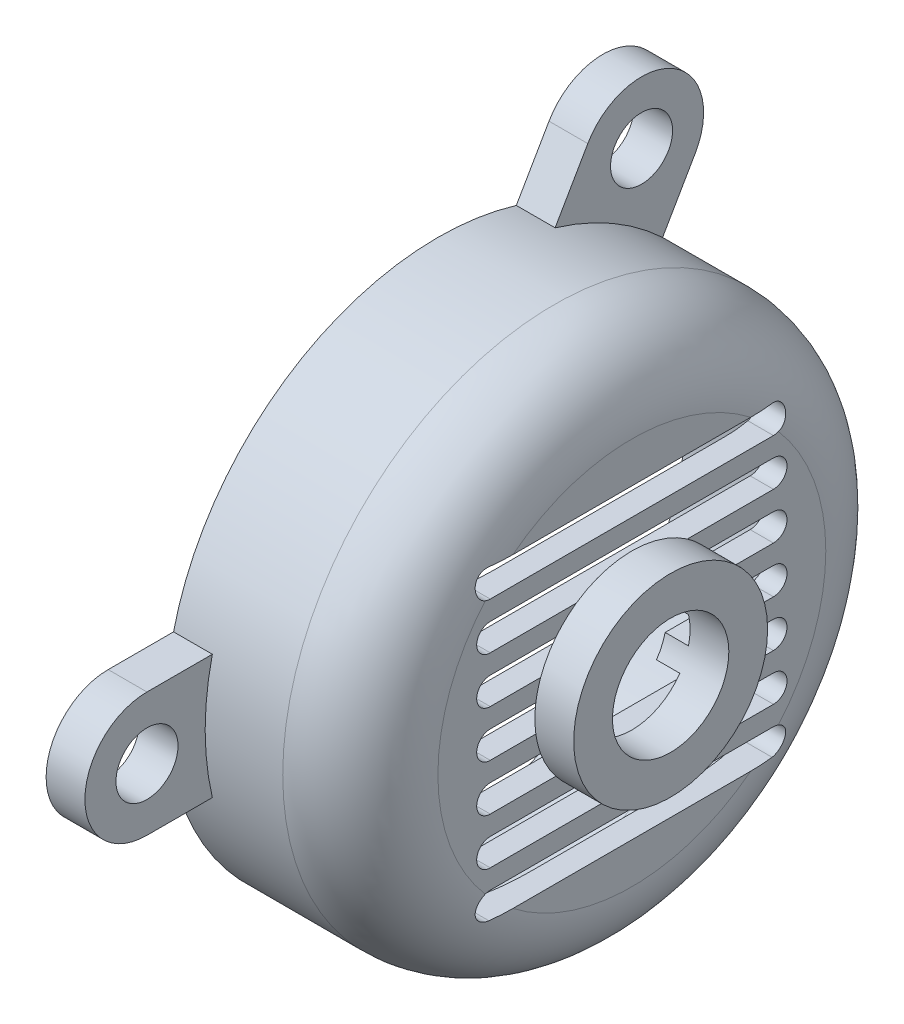
from build123d import *

# Parameters (mm, degrees)
BOSS_EXTRUDE1_START = 5
SKETCH3_R           = 4
BOSS_EXTRUDE1_DEPTH = 5
CIRPATTERN1_COUNT   = 3
CUT_EXTRUDE1_DEPTH  = 5


with BuildPart() as part:
    # Sketch2 → Revolve1 (revolve)
    with BuildSketch(Plane(origin=(0, 0, 0), x_dir=(-1, 0, 0), z_dir=(0, 1, 0)), mode=Mode.PRIVATE) as revolve1_sk:
        with BuildLine():
            Line((-12, 32), (0, 32))
            Line((0, 32), (0, 35))
            Line((0, 35), (-15, 35))
            ThreePointArc((-15, 35), (-22.071067812, 32.071067812), (-25, 25))
            Line((-25, 25), (-25, 12.5))
            Line((-25, 12.5), (-22, 12.5))
            Line((-22, 12.5), (-22, 22))
            ThreePointArc((-22, 22), (-19.071067812, 29.071067812), (-12, 32))
        make_face()
        Polygon((-22, 7.5), (-22, 12.5), (-25, 12.5), (-30, 12.5), (-30, 7.5), align=None)
    revolve(revolve1_sk.sketch.rotate(Axis((0, 0, 0), (-1, 0, 0)), 180), axis=Axis((0, 0, 0), (-1, 0, 0)))

    # Sketch3 → Boss-Extrude1 (add)
    with BuildSketch(Plane.YZ.offset(BOSS_EXTRUDE1_START)):
        with BuildLine():
            Line((8, 34.073450075), (8, 42.5))
            ThreePointArc((8, 42.5), (0, 50.5), (-8, 42.5))
            Line((-8, 42.5), (-8, 34.073450075))
            ThreePointArc((-8, 34.073450075), (0, 35), (8, 34.073450075))
        make_face()
        with Locations(Location((0, 42.5, 0), (0, 0, 270))):
            Circle(SKETCH3_R, mode=Mode.SUBTRACT)
    boss_extrude1 = extrude(amount=-BOSS_EXTRUDE1_DEPTH)

    # CirPattern1: Boss-Extrude1 ×3 about axis
    cirpattern1_axis = Axis((0, 0, 0), (1, 0, 0))
    for i in range(1, CIRPATTERN1_COUNT):
        add(boss_extrude1.rotate(cirpattern1_axis, i * 360 / CIRPATTERN1_COUNT))

    # Sketch4 → Cut-Extrude1 (cut)
    with BuildSketch(Plane.YZ.offset(25)):
        with BuildLine():
            Line((1.75, 18.25), (1.75, -18.25))
            ThreePointArc((1.75, -18.25), (0, -20), (-1.75, -18.25))
            Line((-1.75, -18.25), (-1.75, 18.25))
            ThreePointArc((-1.75, 18.25), (0, 20), (1.75, 18.25))
        make_face()
        with BuildLine():
            Line((7.75, 18.25), (7.75, -18.25))
            ThreePointArc((7.75, -18.25), (6, -20), (4.25, -18.25))
            Line((4.25, -18.25), (4.25, 18.25))
            ThreePointArc((4.25, 18.25), (6, 20), (7.75, 18.25))
        make_face()
        with BuildLine():
            Line((13.75, 18.25), (13.75, -18.25))
            ThreePointArc((13.75, -18.25), (12, -20), (10.25, -18.25))
            Line((10.25, -18.25), (10.25, 18.25))
            ThreePointArc((10.25, 18.25), (12, 20), (13.75, 18.25))
        make_face()
        with BuildLine():
            Line((19.75, 18.25), (19.75, -18.25))
            ThreePointArc((19.75, -18.25), (18, -20), (16.25, -18.25))
            Line((16.25, -18.25), (16.25, 18.25))
            ThreePointArc((16.25, 18.25), (18, 20), (19.75, 18.25))
        make_face()
        with BuildLine():
            Line((-4.25, 18.25), (-4.25, -18.25))
            ThreePointArc((-4.25, -18.25), (-6, -20), (-7.75, -18.25))
            Line((-7.75, -18.25), (-7.75, 18.25))
            ThreePointArc((-7.75, 18.25), (-6, 20), (-4.25, 18.25))
        make_face()
        with BuildLine():
            Line((-10.25, 18.25), (-10.25, -18.25))
            ThreePointArc((-10.25, -18.25), (-12, -20), (-13.75, -18.25))
            Line((-13.75, -18.25), (-13.75, 18.25))
            ThreePointArc((-13.75, 18.25), (-12, 20), (-10.25, 18.25))
        make_face()
        with BuildLine():
            Line((-16.25, 18.25), (-16.25, -18.25))
            ThreePointArc((-16.25, -18.25), (-18, -20), (-19.75, -18.25))
            Line((-19.75, -18.25), (-19.75, 18.25))
            ThreePointArc((-19.75, 18.25), (-18, 20), (-16.25, 18.25))
        make_face()
    extrude(amount=-CUT_EXTRUDE1_DEPTH, mode=Mode.SUBTRACT)


solid = part.part
